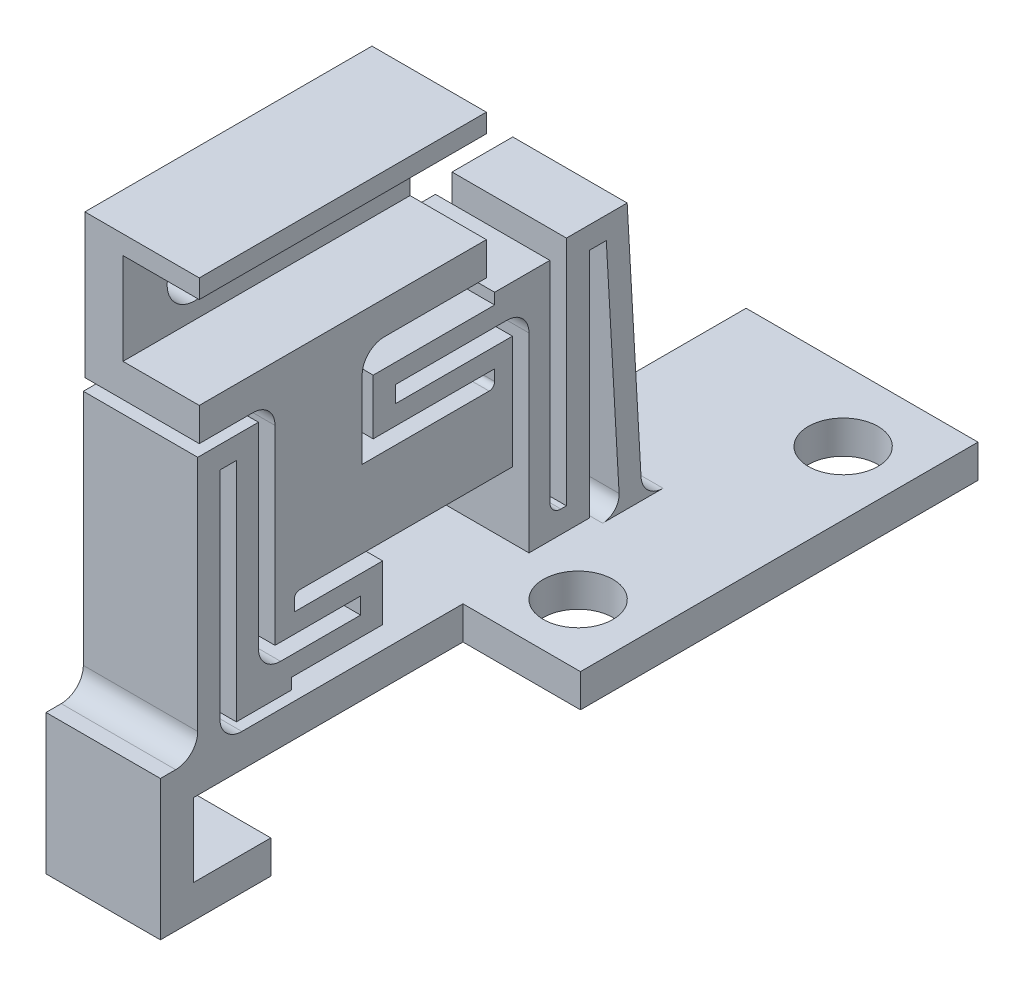
from build123d import *

# Parameters (mm, degrees)
FLEXURE_BOSS_DEPTH            = 5.18
SKETCH2_W                     = 10.5
SKETCH2_H                     = 18
SKETCH2_R                     = 1.575
MOUNTING_PLATE_BOSS_DEPTH     = 1.5
SKETCH7_W                     = 13
SKETCH7_H                     = 4.15
DOVETAIL_CONNECTION_CUT_DEPTH = 3.455
M3X0_5_TAPPED_HOLE1_D         = 2.5
FILLET1_R                     = 1


with BuildPart() as part:
    # Sketch1 → Flexure Boss (new body)
    with BuildSketch(Plane(origin=(0, 0, 0), x_dir=(0, 0, -1), z_dir=(1, 0, 0))):
        with BuildLine():
            ThreePointArc((2.743651747, -2.066915143), (3.036544966, -1.359808362), (3.743651747, -1.066915143))
            Line((3.743651747, -1.066915143), (8.368651984, -1.066915143))
            Line((8.368651984, -1.066915143), (8.368651984, 5.433084857))
            Line((8.368651984, 5.433084857), (-4.631348016, 5.433084857))
            Line((-4.631348016, 5.433084857), (-4.631348016, -1.066915143))
            Line((-4.631348016, -1.066915143), (-2.201142923, -1.066915143))
            ThreePointArc((-2.201142923, -1.066915143), (-1.494036142, -1.359808362), (-1.201142923, -2.066915143))
            Line((-1.201142923, -2.066915143), (-1.201142923, -10.691915143))
            Line((-1.201142923, -10.691915143), (2.673857314, -10.691915143))
            Line((2.673857314, -10.691915143), (2.673857314, -11.441915143))
            Line((2.673857314, -11.441915143), (-0.951142686, -11.441915143))
            ThreePointArc((-0.951142686, -11.441915143), (-1.658249467, -11.149021924), (-1.951142686, -10.441915143))
            Line((-1.951142686, -10.441915143), (-1.951142686, -1.566915143))
            Line((-1.951142686, -1.566915143), (-4.701142686, -1.566915143))
            Line((-4.701142686, -1.566915143), (-4.701142686, -12.316915143))
            ThreePointArc((-4.701142686, -12.316915143), (-4.994035905, -13.024021924), (-5.701142686, -13.316915143))
            Line((-5.701142686, -13.316915143), (-6.391348016, -13.316915143))
            Line((-6.391348016, -13.316915143), (-6.391348016, -19.646915143))
            Line((-6.391348016, -19.646915143), (-1.391348016, -19.646915143))
            Line((-1.391348016, -19.646915143), (-1.391348016, -18.146915143))
            Line((-1.391348016, -18.146915143), (-4.891348016, -18.146915143))
            Line((-4.891348016, -18.146915143), (-4.891348016, -14.816915143))
            Line((-4.891348016, -14.816915143), (-4.631348016, -14.816915143))
            Line((-4.631348016, -14.816915143), (15.425469929, -14.816915143))
            Line((15.425469929, -14.816915143), (15.425469929, -13.316915143))
            Line((15.425469929, -13.316915143), (14.743651747, -1.316915143))
            Line((14.743651747, -1.316915143), (11.993651747, -1.316915143))
            Line((11.993651747, -1.316915143), (11.993651747, -11.816915143))
            Line((11.993651747, -11.816915143), (11.743651747, -11.816915143))
            ThreePointArc((11.743651747, -11.816915143), (11.390098357, -11.670468534), (11.243651747, -11.316915143))
            Line((11.243651747, -11.316915143), (11.243651747, -1.816915143))
            Line((11.243651747, -1.816915143), (8.743651747, -1.816915143))
            Line((8.743651747, -1.816915143), (8.743651747, -2.316915143))
            Line((8.743651747, -2.316915143), (3.243651747, -2.316915143))
            Line((3.243651747, -2.316915143), (3.243651747, -4.816915143))
            Line((3.243651747, -4.816915143), (8.743651747, -4.816915143))
            Line((8.743651747, -4.816915143), (8.743651747, -5.316915143))
            ThreePointArc((8.743651747, -5.316915143), (8.670428443, -5.493691838), (8.493651747, -5.566915143))
            Line((8.493651747, -5.566915143), (2.743651747, -5.566915143))
            Line((2.743651747, -5.566915143), (2.743651747, -2.066915143))
        make_face()
        with BuildLine():
            ThreePointArc((-0.326142923, -9.316915143), (-0.252919618, -9.140138448), (-0.076142923, -9.066915143))
            Line((-0.076142923, -9.066915143), (9.548857077, -9.066915143))
            Line((9.548857077, -9.066915143), (9.548857077, -3.941915143))
            Line((9.548857077, -3.941915143), (4.243651747, -3.941915143))
            Line((4.243651747, -3.941915143), (4.243651747, -3.191915143))
            Line((4.243651747, -3.191915143), (9.298857077, -3.191915143))
            ThreePointArc((9.298857077, -3.191915143), (10.005963858, -3.484808362), (10.298857077, -4.191915143))
            Line((10.298857077, -4.191915143), (10.298857077, -12.816915143))
            Line((10.298857077, -12.816915143), (13.048857077, -12.816915143))
            Line((13.048857077, -12.816915143), (13.048857077, -2.316915143))
            Line((13.048857077, -2.316915143), (13.798857077, -2.316915143))
            Line((13.798857077, -2.316915143), (14.37882611, -12.524370125))
            ThreePointArc((14.37882611, -12.524370125), (14.175198347, -13.0819837), (13.630033801, -13.316915143))
            Line((13.630033801, -13.316915143), (-2.701142686, -13.316915143))
            ThreePointArc((-2.701142686, -13.316915143), (-3.408249467, -13.024021924), (-3.701142686, -12.316915143))
            Line((-3.701142686, -12.316915143), (-3.701142686, -2.566915143))
            Line((-3.701142686, -2.566915143), (-2.951142686, -2.566915143))
            Line((-2.951142686, -2.566915143), (-2.951142686, -12.816915143))
            Line((-2.951142686, -12.816915143), (-0.451142686, -12.816915143))
            Line((-0.451142686, -12.816915143), (-0.451142686, -12.316915143))
            Line((-0.451142686, -12.316915143), (3.673857314, -12.316915143))
            Line((3.673857314, -12.316915143), (3.673857314, -9.816915143))
            Line((3.673857314, -9.816915143), (-0.326142923, -9.816915143))
            Line((-0.326142923, -9.816915143), (-0.326142923, -9.316915143))
        make_face(mode=Mode.SUBTRACT)
    extrude(amount=FLEXURE_BOSS_DEPTH)

    # Sketch2 → Mounting Plate Boss (add)
    with BuildSketch(Plane.XZ.offset(14.816915143)):
        with Locations((-0.07, -16.309568548)):
            Rectangle(SKETCH2_W, SKETCH2_H)
        with Locations(Location((-2.435, -10.088651984, 0), (0, 0, 270))):
            Circle(SKETCH2_R, mode=Mode.SUBTRACT)
        with Locations(Location((-2.435, -22.088651984, 0), (0, 0, 270))):
            Circle(SKETCH2_R, mode=Mode.SUBTRACT)
    extrude(amount=-MOUNTING_PLATE_BOSS_DEPTH)

    # Sketch7 → Dovetail Connection Cut (cut)
    with BuildSketch(Plane.ZY):
        with Locations((-1.868651984, 2.508084857)):
            Rectangle(SKETCH7_W, SKETCH7_H)
    extrude(amount=-DOVETAIL_CONNECTION_CUT_DEPTH, mode=Mode.SUBTRACT)

    # M3x0.5 Tapped Hole1 (through all)
    with Locations(Plane(origin=(5.18, 0, 0), x_dir=(0, 0, -1), z_dir=(1, 0, 0))):
        with Locations((-1.381348016, 2.433084857), (5.118651984, 2.433084857)):
            Hole(M3X0_5_TAPPED_HOLE1_D / 2)


with BuildPart() as body_2:
    # Mirror2: mirrored copy
    add(part.part.mirror(Plane(origin=(5.18, 0, 0), x_dir=(0, 0, 1), z_dir=(1, 0, 0))))

    # Fillet1
    fillet1_edges = [body_2.edges().sort_by_distance(p)[0] for p in [
        (7.77, -13.316915143, -15.425469929),
    ]]
    fillet(fillet1_edges, radius=FILLET1_R)


solid = body_2.part
